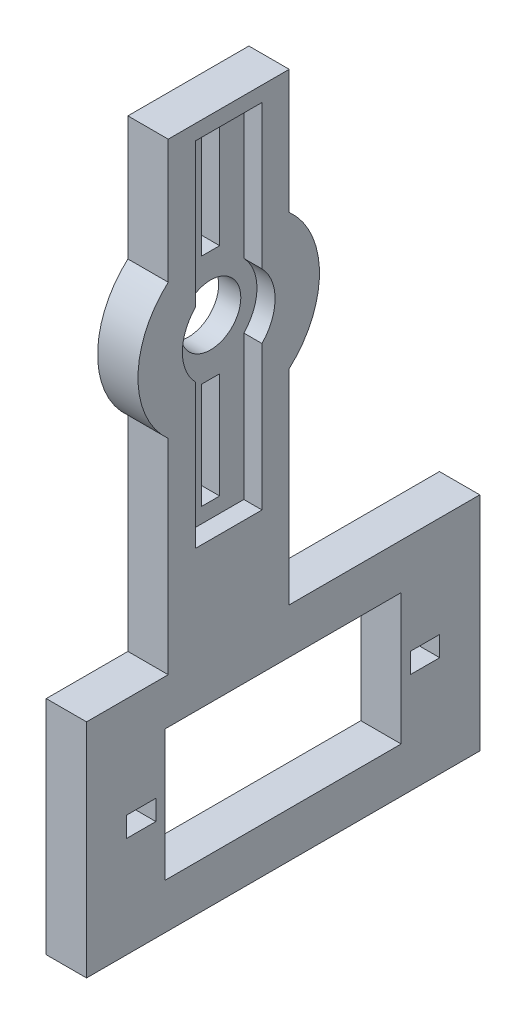
from build123d import *

# Parameters (mm, degrees)
BOSS_EXTRUDE1_START  = -59.6
SKETCH1_R            = 9
BOSS_EXTRUDE1_DEPTH  = 4
BOSS_EXTRUDE2_START  = 60
SKETCH2_W            = 4
SKETCH2_H            = 49
BOSS_EXTRUDE2_DEPTH  = 12
BOSS_EXTRUDE3_START  = 41.1
SKETCH3_W            = 4
SKETCH3_H            = 22
BOSS_EXTRUDE3_DEPTH  = 39
BOSS_EXTRUDE4_START  = -57.4
SKETCH4_R            = 4.6
BOSS_EXTRUDE4_DEPTH  = 2.3
BOSS_EXTRUDE5_START  = 62.7
SKETCH5_W            = 2.3
SKETCH5_H            = 17.5
BOSS_EXTRUDE5_DEPTH  = 6.6
BOSS_EXTRUDE6_START  = 65.1
SKETCH6_W            = 6
SKETCH6_H            = 10.5
BOSS_EXTRUDE6_DEPTH  = 1.8
BOSS_EXTRUDE7_START  = 62.7
SKETCH7_W            = 2.3
SKETCH7_H            = 17.5
BOSS_EXTRUDE7_DEPTH  = 6.6
BOSS_EXTRUDE8_START  = 65.1
SKETCH8_W            = 6
SKETCH8_H            = 10.5
BOSS_EXTRUDE8_DEPTH  = 1.8
BOSS_EXTRUDE9_START  = -60.6
SKETCH9_R            = 3
BOSS_EXTRUDE9_DEPTH  = 6
BOSS_EXTRUDE10_START = 48.9
SKETCH10_W           = 6
SKETCH10_H           = 13
BOSS_EXTRUDE10_DEPTH = 23.4
BOSS_EXTRUDE11_START = 45.075
SKETCH11_W           = 6
SKETCH11_H           = 2
BOSS_EXTRUDE11_DEPTH = 2.9
BOSS_EXTRUDE12_START = 73.225
SKETCH12_W           = 6
SKETCH12_H           = 2
BOSS_EXTRUDE12_DEPTH = 2.9


with BuildPart() as part:
    # Sketch1 → Boss-Extrude1 (new body)
    with BuildSketch(Plane(origin=(0, 0, 0), x_dir=(0, 0, -1), z_dir=(1, 0, 0)).offset(BOSS_EXTRUDE1_START)):
        with Locations((-66, 18)):
            Circle(SKETCH1_R)
    extrude(amount=BOSS_EXTRUDE1_DEPTH)

    # Sketch2 → Boss-Extrude2 (add)
    with BuildSketch(Plane.XY.offset(BOSS_EXTRUDE2_START)):
        with Locations((-57.6, 12.5)):
            Rectangle(SKETCH2_W, SKETCH2_H)
    extrude(amount=BOSS_EXTRUDE2_DEPTH)

    # Sketch3 → Boss-Extrude3 (add)
    with BuildSketch(Plane.XY.offset(BOSS_EXTRUDE3_START)):
        with Locations((-57.6, -20)):
            Rectangle(SKETCH3_W, SKETCH3_H)
    extrude(amount=BOSS_EXTRUDE3_DEPTH)


with BuildPart() as body_2:
    # Sketch4 → Boss-Extrude4 (new body)
    with BuildSketch(Plane(origin=(0, 0, 0), x_dir=(0, 0, -1), z_dir=(1, 0, 0)).offset(BOSS_EXTRUDE4_START)):
        with Locations((-66, 18)):
            Circle(SKETCH4_R)
    extrude(amount=BOSS_EXTRUDE4_DEPTH)


with BuildPart() as part_1:
    add(part.part)

    # Combine1: cut body 2
    add(body_2.part, mode=Mode.SUBTRACT)


with BuildPart() as body_2_2:
    # Sketch5 → Boss-Extrude5 (new body)
    with BuildSketch(Plane.XY.offset(BOSS_EXTRUDE5_START)):
        with Locations((-56.25, 26.75)):
            Rectangle(SKETCH5_W, SKETCH5_H)
    extrude(amount=BOSS_EXTRUDE5_DEPTH)


with BuildPart() as part_2:
    add(part_1.part)

    # Combine2: cut body 2 2
    add(body_2_2.part, mode=Mode.SUBTRACT)


with BuildPart() as body_2_3:
    # Sketch6 → Boss-Extrude6 (new body)
    with BuildSketch(Plane.XY.offset(BOSS_EXTRUDE6_START)):
        with Locations((-57.6, 28.75)):
            Rectangle(SKETCH6_W, SKETCH6_H)
    extrude(amount=BOSS_EXTRUDE6_DEPTH)


with BuildPart() as part_3:
    add(part_2.part)

    # Combine3: cut body 2 3
    add(body_2_3.part, mode=Mode.SUBTRACT)


with BuildPart() as body_2_4:
    # Sketch7 → Boss-Extrude7 (new body)
    with BuildSketch(Plane.XY.offset(BOSS_EXTRUDE7_START)):
        with Locations((-56.25, 9.25)):
            Rectangle(SKETCH7_W, SKETCH7_H)
    extrude(amount=BOSS_EXTRUDE7_DEPTH)


with BuildPart() as part_4:
    add(part_3.part)

    # Combine4: cut body 2 4
    add(body_2_4.part, mode=Mode.SUBTRACT)


with BuildPart() as body_2_5:
    # Sketch8 → Boss-Extrude8 (new body)
    with BuildSketch(Plane.XY.offset(BOSS_EXTRUDE8_START)):
        with Locations((-57.6, 7.25)):
            Rectangle(SKETCH8_W, SKETCH8_H)
    extrude(amount=BOSS_EXTRUDE8_DEPTH)


with BuildPart() as part_5:
    add(part_4.part)

    # Combine5: cut body 2 5
    add(body_2_5.part, mode=Mode.SUBTRACT)


with BuildPart() as body_2_6:
    # Sketch9 → Boss-Extrude9 (new body)
    with BuildSketch(Plane(origin=(0, 0, 0), x_dir=(0, 0, -1), z_dir=(1, 0, 0)).offset(BOSS_EXTRUDE9_START)):
        with Locations((-66, 18)):
            Circle(SKETCH9_R)
    extrude(amount=BOSS_EXTRUDE9_DEPTH)


with BuildPart() as part_6:
    add(part_5.part)

    # Combine6: cut body 2 6
    add(body_2_6.part, mode=Mode.SUBTRACT)


with BuildPart() as body_2_7:
    # Sketch10 → Boss-Extrude10 (new body)
    with BuildSketch(Plane.XY.offset(BOSS_EXTRUDE10_START)):
        with Locations((-57.6, -20)):
            Rectangle(SKETCH10_W, SKETCH10_H)
    extrude(amount=BOSS_EXTRUDE10_DEPTH)


with BuildPart() as part_7:
    add(part_6.part)

    # Combine7: cut body 2 7
    add(body_2_7.part, mode=Mode.SUBTRACT)


with BuildPart() as body_2_8:
    # Sketch11 → Boss-Extrude11 (new body)
    with BuildSketch(Plane.XY.offset(BOSS_EXTRUDE11_START)):
        with Locations((-57.6, -20)):
            Rectangle(SKETCH11_W, SKETCH11_H)
    extrude(amount=BOSS_EXTRUDE11_DEPTH)


with BuildPart() as part_8:
    add(part_7.part)

    # Combine8: cut body 2 8
    add(body_2_8.part, mode=Mode.SUBTRACT)


with BuildPart() as body_2_9:
    # Sketch12 → Boss-Extrude12 (new body)
    with BuildSketch(Plane.XY.offset(BOSS_EXTRUDE12_START)):
        with Locations((-57.6, -20)):
            Rectangle(SKETCH12_W, SKETCH12_H)
    extrude(amount=BOSS_EXTRUDE12_DEPTH)


with BuildPart() as part_9:
    add(part_8.part)

    # Combine9: cut body 2 9
    add(body_2_9.part, mode=Mode.SUBTRACT)


solid = part_9.part
